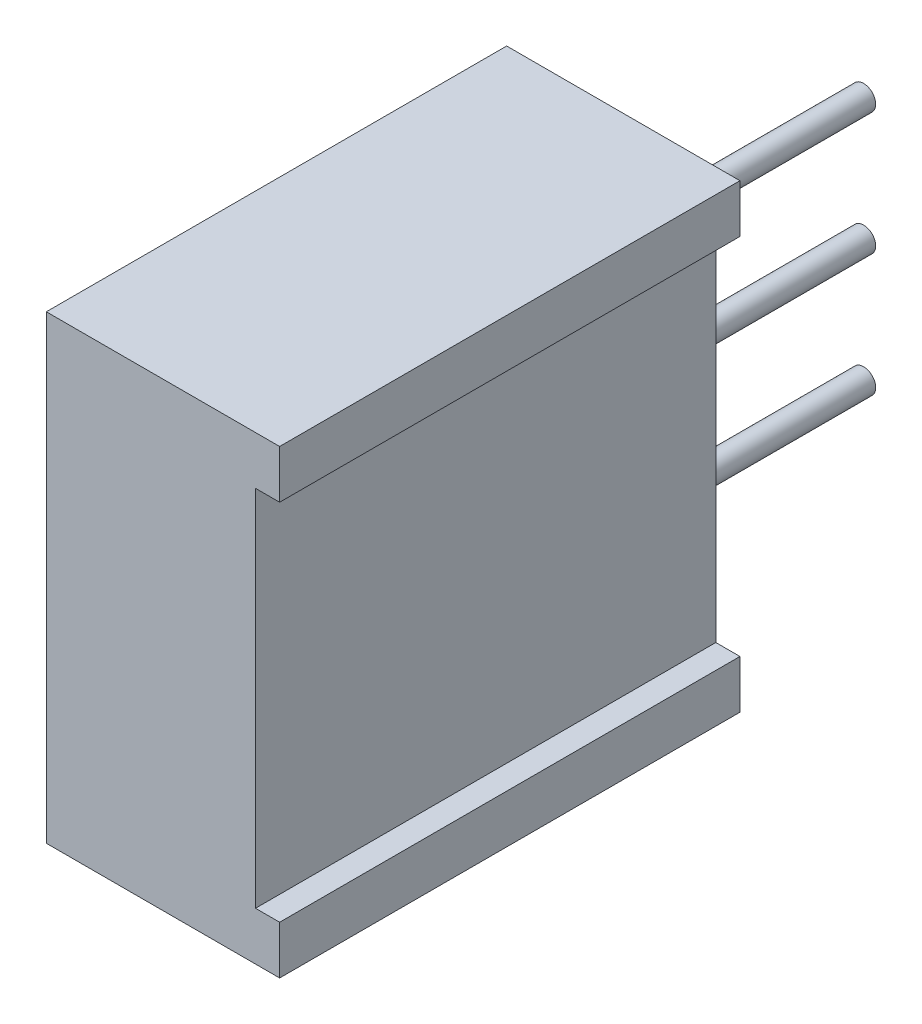
from build123d import *

# Parameters (mm, degrees)
SKETCH1_W         = 9.53
SKETCH1_H         = 9.53
BASIC_SHAPE_DEPTH = 4.83
SKETCH5_R         = 0.25
PINS_DEPTH        = 5
SKETCH6_W         = 0.5
SKETCH6_H         = 7.53
REAR_RELIEF_DEPTH = 19.035262682


with BuildPart() as part:
    # Sketch1 → Basic Shape (new body)
    with BuildSketch(Plane(origin=(0, 0, 0), x_dir=(0, 0, 1), z_dir=(1, 0, 0))):
        with Locations((4.765, 4.765)):
            Rectangle(SKETCH1_W, SKETCH1_H)
    extrude(amount=BASIC_SHAPE_DEPTH)

    # Sketch5 → Pins (add)
    with BuildSketch(Plane(origin=(0, -19.06, 0), x_dir=(0, -1, 0), z_dir=(0, 0, -1))):
        with Locations(Location((-16.835, -2.39, 0), (0, 0, 90))):
            Circle(SKETCH5_R)
        with Locations(Location((-14.295, -2.39, 0), (0, 0, 90))):
            Circle(SKETCH5_R)
        with Locations(Location((-11.755, -2.39, 0), (0, 0, 90))):
            Circle(SKETCH5_R)
    extrude(amount=PINS_DEPTH)

    # Sketch6 → Rear Relief (cut, through all)
    with BuildSketch(Plane.XY.offset(9.53)):
        with Locations((4.58, -4.765)):
            Rectangle(SKETCH6_W, SKETCH6_H)
    extrude(amount=-REAR_RELIEF_DEPTH, mode=Mode.SUBTRACT)


solid = part.part
